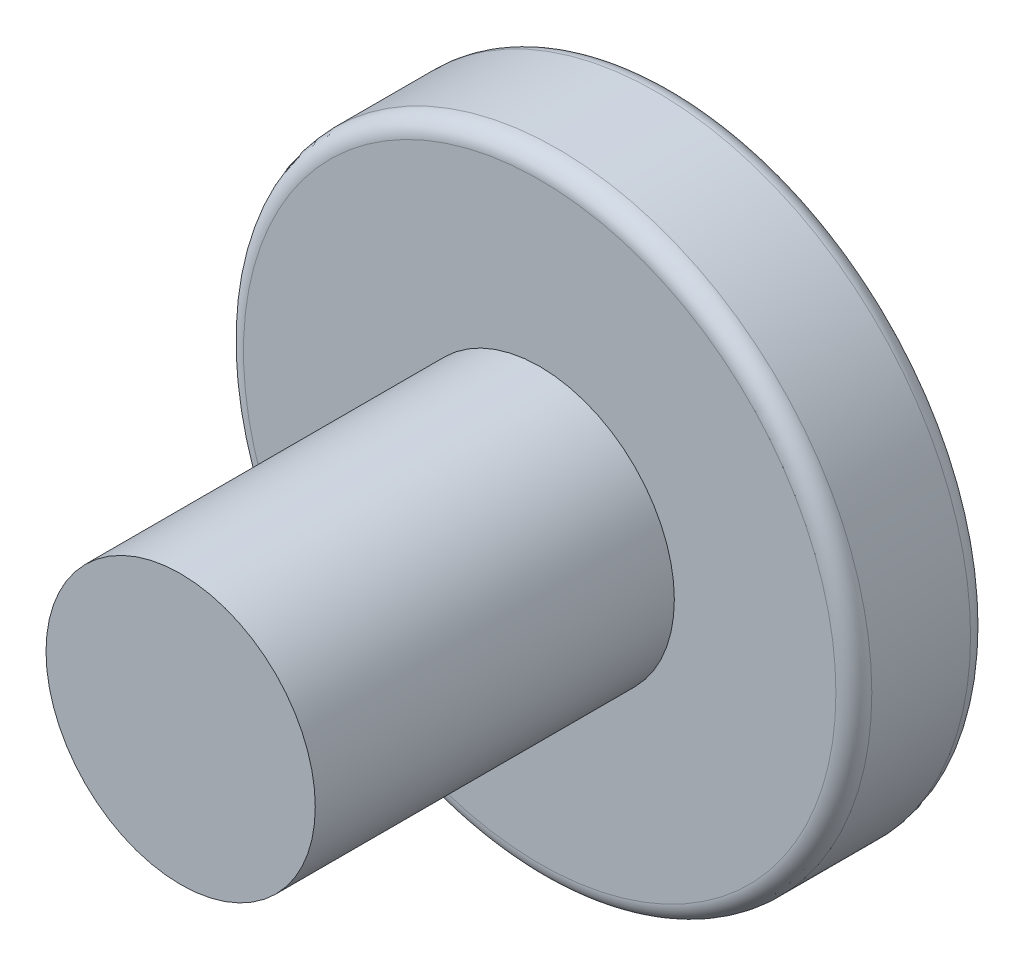
from build123d import *

# Parameters (mm, degrees)
SKETCH_1_R          = 3.5
EXTRUDE_1_DEPTH     = 1.5
SKETCH_2_R          = 1.5
EXTRUDE_2_DEPTH     = 4
FILLET_1_R          = 0.2
CUT_EXTRUDE_1_DEPTH = 1.5


with BuildPart() as part:
    # 草图1 → 凸台-拉伸1 (new body)
    with BuildSketch(Plane.XY):
        Circle(SKETCH_1_R)
    extrude(amount=EXTRUDE_1_DEPTH)

    # 草图2 → 凸台-拉伸2 (add)
    with BuildSketch(Plane.XY.offset(1.5)):
        Circle(SKETCH_2_R)
    extrude(amount=EXTRUDE_2_DEPTH)

    # 圆角1
    fillet_1_edges = [part.edges().sort_by_distance(p)[0] for p in [
        (-3.5, 0, 0),
        (-3.5, 0, 1.5),
    ]]
    fillet(fillet_1_edges, radius=FILLET_1_R)

    # 草图3 → 切除-拉伸1 (cut)
    with BuildSketch(Plane(origin=(0, 0, 0), x_dir=(-1, 0, 0), z_dir=(0, 0, -1))):
        Polygon((1.154700538, 0), (0.577350269, 1), (-0.577350269, 1), (-1.154700538, 0), (-0.577350269, -1), (0.577350269, -1), align=None)
    extrude(amount=-CUT_EXTRUDE_1_DEPTH, mode=Mode.SUBTRACT)


solid = part.part
